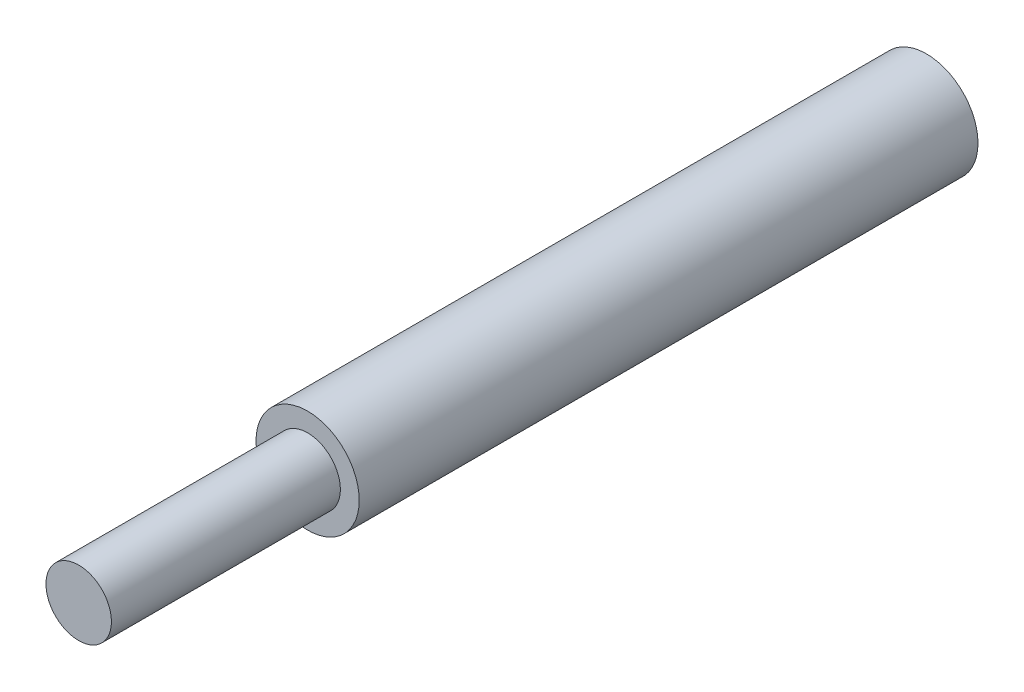
from build123d import *

# Parameters (mm, degrees)
ROD_AT_MIDSTROKE_30MM_START           = 44.5
SKETCH1_R                             = 5
ROD_AT_MIDSTROKE_30MM_DEPTH           = 60
QUARTER20_THREAD_MAJOR_ENVELOPE_START = 104.5
SKETCH2_R                             = 3.175
QUARTER20_THREAD_MAJOR_ENVELOPE_DEPTH = 22.2


with BuildPart() as part:
    # Sketch1 → Rod_At_Midstroke_30mm (new body)
    with BuildSketch(Plane.XY.offset(ROD_AT_MIDSTROKE_30MM_START)):
        Circle(SKETCH1_R)
    extrude(amount=ROD_AT_MIDSTROKE_30MM_DEPTH)

    # Sketch2 → Quarter20_Thread_Major_Envelope (add)
    with BuildSketch(Plane.XY.offset(QUARTER20_THREAD_MAJOR_ENVELOPE_START)):
        Circle(SKETCH2_R)
    extrude(amount=QUARTER20_THREAD_MAJOR_ENVELOPE_DEPTH)


solid = part.part
